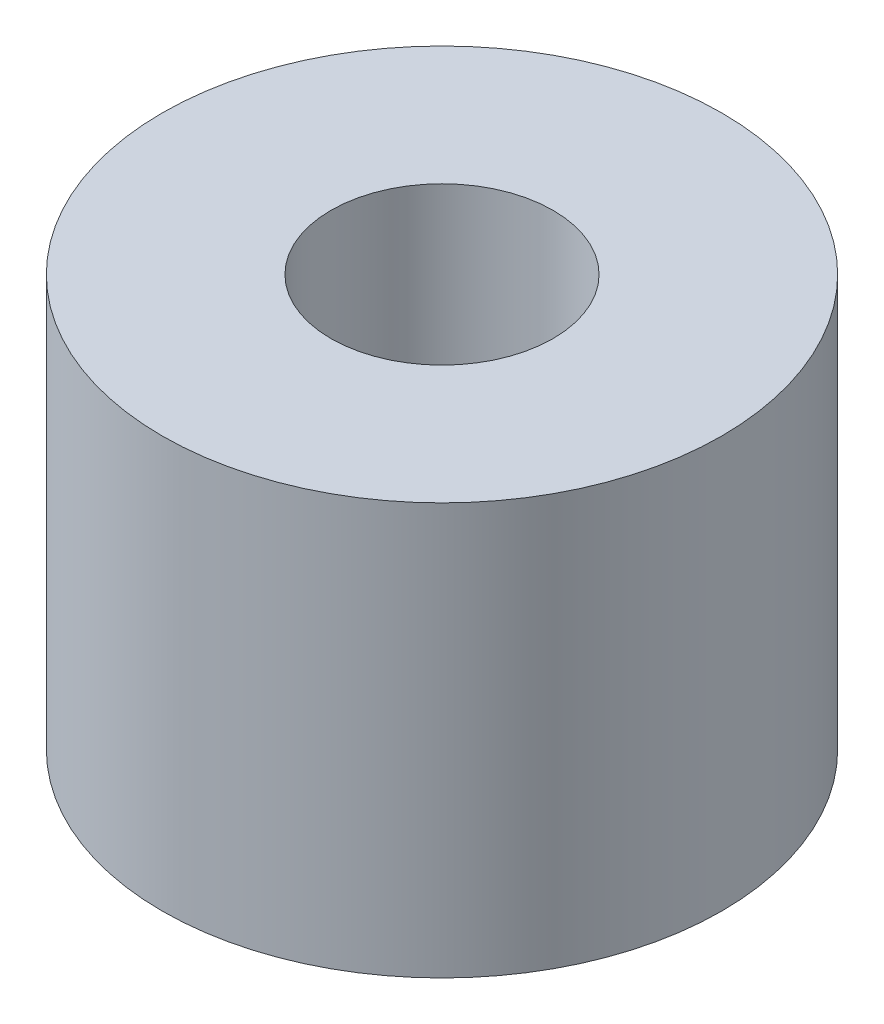
from build123d import *

# Parameters (mm, degrees)
SKETCH1_R           = 4.318
SKETCH1_R_2         = 1.7145
BOSS_EXTRUDE1_DEPTH = 6.35


with BuildPart() as part:
    # Sketch1 → Boss-Extrude1 (new body)
    with BuildSketch(Plane(origin=(0, 0, 0), x_dir=(1, 0, 0), z_dir=(0, 1, 0))):
        with Locations(Location((0, 0, 0), (0, 0, 270))):
            Circle(SKETCH1_R)
        with Locations(Location((0, 0, 0), (0, 0, 270))):
            Circle(SKETCH1_R_2, mode=Mode.SUBTRACT)
    extrude(amount=BOSS_EXTRUDE1_DEPTH)


solid = part.part
